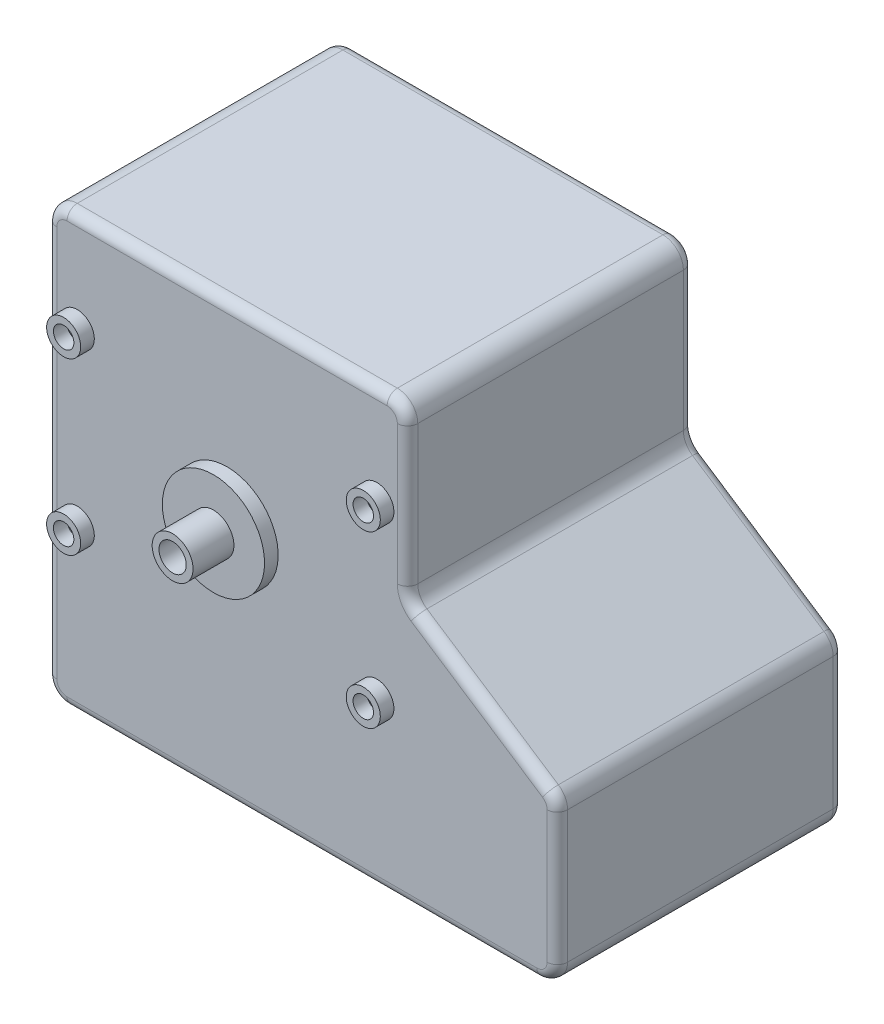
from build123d import *

# Parameters (mm, degrees)
BOSS_EXTRUDE1_DEPTH = 21
SKETCH3_R           = 2.5
SKETCH3_R_2         = 1.5
BOSS_EXTRUDE2_DEPTH = 2
SKETCH5_R           = 7.5
BOSS_EXTRUDE4_DEPTH = 2
FILLET1_R           = 3
FILLET2_R           = 1.5
SKETCH7_R           = 3
BOSS_EXTRUDE6_DEPTH = 6
SKETCH8_R           = 2
CUT_EXTRUDE2_DEPTH  = 77.552677941
BOSS_EXTRUDE7_DEPTH = 8


with BuildPart() as part:
    # Sketch2 → Boss-Extrude1 (new, symmetric)
    with BuildSketch(Plane.XY):
        Polygon((26.5, 6.75), (48.5, -7.75), (48.5, -31.75), (26.5, -31.75), (-26.5, -31.75), (-26.5, 31.75), (26.5, 31.75), align=None)
    extrude(amount=BOSS_EXTRUDE1_DEPTH, both=True)

    # Sketch3 → Boss-Extrude2 (add)
    # profile 1 of 4: a face of its own
    with BuildSketch(Plane.XY.offset(21)):
        with Locations(Location((-22, 17.25, 0), (0, 0, 180))):
            Circle(SKETCH3_R)
        with Locations((-22, 17.25)):
            Circle(SKETCH3_R_2, mode=Mode.SUBTRACT)
    # profile 2 of 4: a face of its own
    with BuildSketch(Plane.XY.offset(21)):
        with Locations(Location((22, 17.25, 0), (0, 0, 180))):
            Circle(SKETCH3_R)
        with Locations((22, 17.25)):
            Circle(SKETCH3_R_2, mode=Mode.SUBTRACT)
    # profile 3 of 4: a face of its own
    with BuildSketch(Plane.XY.offset(21)):
        with Locations(Location((-22, -7.75, 0), (0, 0, 180))):
            Circle(SKETCH3_R)
        with Locations((-22, -7.75)):
            Circle(SKETCH3_R_2, mode=Mode.SUBTRACT)
    # profile 4 of 4: a face of its own
    with BuildSketch(Plane.XY.offset(21)):
        with Locations(Location((22, -7.75, 0), (0, 0, 180))):
            Circle(SKETCH3_R)
        with Locations((22, -7.75)):
            Circle(SKETCH3_R_2, mode=Mode.SUBTRACT)
    extrude(amount=BOSS_EXTRUDE2_DEPTH)

    # Sketch5 → Boss-Extrude4 (add)
    with BuildSketch(Plane.XY.offset(21)):
        with Locations(Location((0, 3.25, 0), (0, 0, 180))):
            Circle(SKETCH5_R)
    extrude(amount=BOSS_EXTRUDE4_DEPTH)

    # Fillet1
    fillet1_edges = [part.edges().sort_by_distance(p)[0] for p in [
        (26.5, 6.75, 0),
        (48.5, -7.75, 0),
        (48.5, -31.75, 0),
        (-26.5, -31.75, 0),
        (-26.5, 31.75, 0),
        (26.5, 31.75, 0),
    ]]
    fillet(fillet1_edges, radius=FILLET1_R)

    # Fillet2
    fillet2_edges = [part.edges().sort_by_distance(p)[0] for p in [
        (11, -31.75, -21),
        (11, -31.75, 21),
        (26.5, 18.557860744, -21),
        (37.5, -0.5, -21),
        (48.5, -19.057860744, -21),
        (-26.5, 0, -21),
        (0, 31.75, -21),
        (25.621320344, 30.871320344, -21),
        (48.141289482, -7.943192097, -21),
        (47.621320344, -30.871320344, -21),
        (-25.621320344, 30.871320344, -21),
        (-25.621320344, -30.871320344, -21),
        (-26.5, 0, 21),
        (26.5, 18.557860744, 21),
        (0, 31.75, 21),
        (48.5, -19.057860744, 21),
        (37.5, -0.5, 21),
        (25.621320344, 30.871320344, 21),
        (48.141289482, -7.943192097, 21),
        (47.621320344, -30.871320344, 21),
        (-25.621320344, 30.871320344, 21),
        (-25.621320344, -30.871320344, 21),
        (26.858710518, 6.943192097, -21),
        (26.858710518, 6.943192097, 21),
    ]]
    fillet(fillet2_edges, radius=FILLET2_R)

    # Sketch7 → Boss-Extrude6 (add)
    with BuildSketch(Plane.XY.offset(23)):
        with Locations((0, 3.25)):
            Circle(SKETCH7_R)
    extrude(amount=BOSS_EXTRUDE6_DEPTH)

    # Sketch8 → Cut-Extrude2 (cut, through all)
    with BuildSketch(Plane.XY.offset(29)):
        with Locations((0, 3.25)):
            Circle(SKETCH8_R)
    extrude(amount=-CUT_EXTRUDE2_DEPTH, mode=Mode.SUBTRACT)

    # Sketch9 → Boss-Extrude7 (add)
    with BuildSketch(Plane(origin=(0, 0, -21), x_dir=(-1, 0, 0), z_dir=(0, 0, -1))):
        with BuildLine():
            Line((-7.5, -9.25), (7.5, -9.25))
            ThreePointArc((7.5, -9.25), (11.035533906, -7.785533906), (12.5, -4.25))
            Line((12.5, -4.25), (12.5, 10.75))
            ThreePointArc((12.5, 10.75), (11.035533906, 14.285533906), (7.5, 15.75))
            Line((7.5, 15.75), (-7.5, 15.75))
            ThreePointArc((-7.5, 15.75), (-11.035533906, 14.285533906), (-12.5, 10.75))
            Line((-12.5, 10.75), (-12.5, -4.25))
            ThreePointArc((-12.5, -4.25), (-11.035533906, -7.785533906), (-7.5, -9.25))
        make_face()
    extrude(amount=BOSS_EXTRUDE7_DEPTH)


solid = part.part
